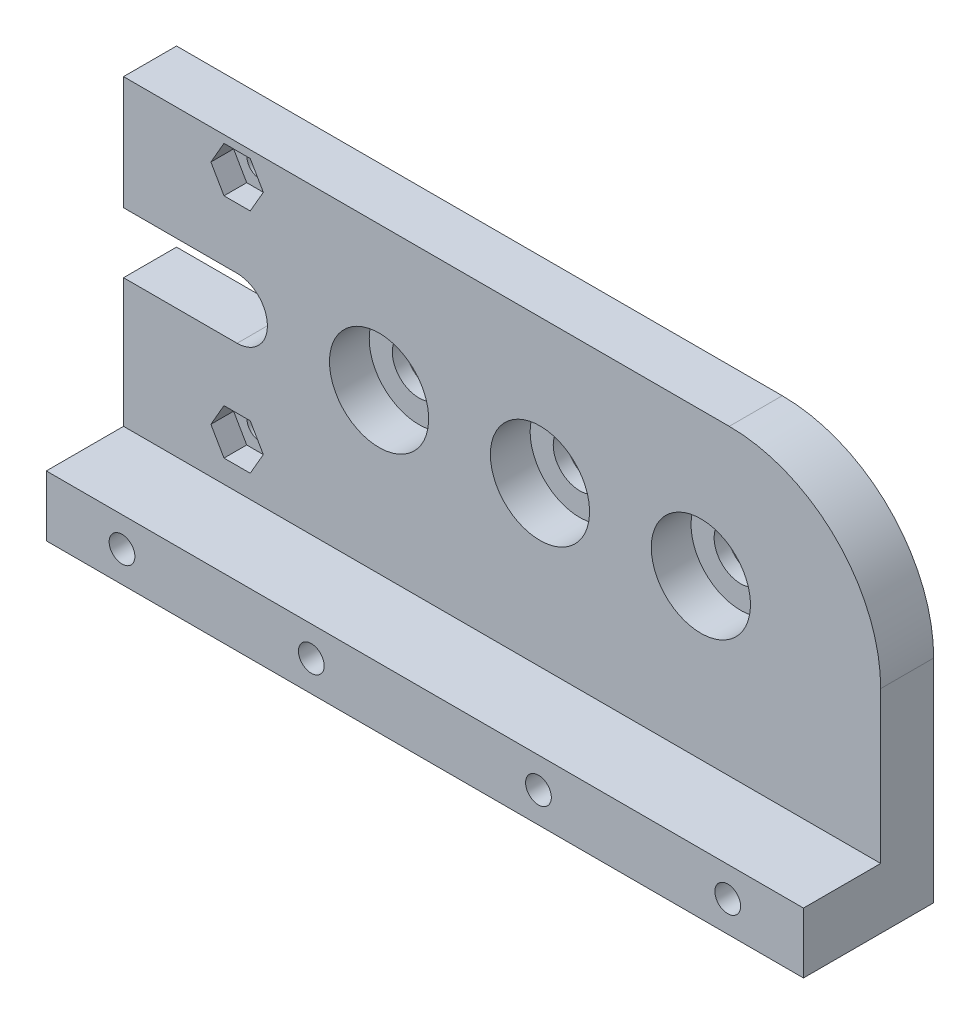
from build123d import *

# Parameters (mm, degrees)
SKETCH1_W           = 100
SKETCH1_H           = 48
BOSS_EXTRUDE1_DEPTH = 7
CUT_EXTRUDE1_REACH  = 113.144
SKETCH2_R           = 4
SKETCH2_R_2         = 3.5
SKETCH3_W           = 100
SKETCH3_H           = 8
BOSS_EXTRUDE2_DEPTH = 10.2
SKETCH4_R           = 6.55
CUT_EXTRUDE2_DEPTH  = 5.25
SKETCH5_R           = 2.6
CUT_EXTRUDE3_DEPTH  = 7
SKETCH7_R           = 1.7
CUT_EXTRUDE4_DEPTH  = 112.391382072
CUT_EXTRUDE5_REACH  = 114.249
SKETCH8_R           = 1.7
CUT_EXTRUDE6_DEPTH  = 3
CUT_EXTRUDE7_REACH  = 114.249
SKETCH10_R          = 1.7
CUT_EXTRUDE8_DEPTH  = 3
FILLET1_R           = 20


with BuildPart() as part:
    # Sketch1 → Boss-Extrude1 (new body)
    with BuildSketch(Plane.XY):
        with Locations((50, 24)):
            Rectangle(SKETCH1_W, SKETCH1_H)
    extrude(amount=BOSS_EXTRUDE1_DEPTH)

    # Sketch2 → Cut-Extrude1 (cut, up to next)
    with BuildSketch(Plane.XY.offset(7), mode=Mode.PRIVATE) as cut_extrude1_sk1:
        with BuildLine():
            ThreePointArc((15, 25), (11, 29), (15, 33))
            Line((15, 33), (0, 33))
            Line((0, 33), (0, 25))
            Line((0, 25), (15, 25))
        make_face()
    cut_extrude1_tool1 = extrude(cut_extrude1_sk1.sketch, amount=-CUT_EXTRUDE1_REACH, mode=Mode.PRIVATE) & part.part
    # Sketch2 → Cut-Extrude1 (cut, up to next)
    with BuildSketch(Plane.XY.offset(7), mode=Mode.PRIVATE) as cut_extrude1_sk2:
        with Locations((15, 29)):
            Circle(SKETCH2_R)
    cut_extrude1_tool2 = extrude(cut_extrude1_sk2.sketch, amount=-CUT_EXTRUDE1_REACH, mode=Mode.PRIVATE) & part.part
    # Sketch2 → Cut-Extrude1 (cut, up to next)
    with BuildSketch(Plane.XY.offset(7), mode=Mode.PRIVATE) as cut_extrude1_sk3:
        with Locations((33.75, 29)):
            Circle(SKETCH2_R_2)
    cut_extrude1_tool3 = extrude(cut_extrude1_sk3.sketch, amount=-CUT_EXTRUDE1_REACH, mode=Mode.PRIVATE) & part.part
    # Sketch2 → Cut-Extrude1 (cut, up to next)
    with BuildSketch(Plane.XY.offset(7), mode=Mode.PRIVATE) as cut_extrude1_sk4:
        with Locations((55, 29)):
            Circle(SKETCH2_R_2)
    cut_extrude1_tool4 = extrude(cut_extrude1_sk4.sketch, amount=-CUT_EXTRUDE1_REACH, mode=Mode.PRIVATE) & part.part
    # Sketch2 → Cut-Extrude1 (cut, up to next)
    with BuildSketch(Plane.XY.offset(7), mode=Mode.PRIVATE) as cut_extrude1_sk5:
        with Locations((76.25, 29)):
            Circle(SKETCH2_R_2)
    cut_extrude1_tool5 = extrude(cut_extrude1_sk5.sketch, amount=-CUT_EXTRUDE1_REACH, mode=Mode.PRIVATE) & part.part
    add(cut_extrude1_tool1.solids().sort_by_distance((5.962811, 29, 7))[0], mode=Mode.SUBTRACT)
    add(cut_extrude1_tool2.solids().sort_by_distance((15, 29, 7))[0], mode=Mode.SUBTRACT)
    add(cut_extrude1_tool3.solids().sort_by_distance((33.75, 29, 7))[0], mode=Mode.SUBTRACT)
    add(cut_extrude1_tool4.solids().sort_by_distance((55, 29, 7))[0], mode=Mode.SUBTRACT)
    add(cut_extrude1_tool5.solids().sort_by_distance((76.25, 29, 7))[0], mode=Mode.SUBTRACT)

    # Sketch3 → Boss-Extrude2 (add)
    with BuildSketch(Plane(origin=(0, 0, 0), x_dir=(-1, 0, 0), z_dir=(0, 0, -1))):
        with Locations((-50, 4)):
            Rectangle(SKETCH3_W, SKETCH3_H)
    extrude(amount=BOSS_EXTRUDE2_DEPTH)

    # Sketch4 → Cut-Extrude2 (cut)
    with BuildSketch(Plane(origin=(0, 0, 0), x_dir=(-1, 0, 0), z_dir=(0, 0, -1))):
        with Locations((-76.25, 29)):
            Circle(SKETCH4_R)
        with Locations((-55, 29)):
            Circle(SKETCH4_R)
        with Locations((-33.75, 29)):
            Circle(SKETCH4_R)
    extrude(amount=-CUT_EXTRUDE2_DEPTH, mode=Mode.SUBTRACT)

    # Sketch5 → Cut-Extrude3 (cut)
    with BuildSketch(Plane.XY.offset(7)):
        with Locations((35.000022648, 4.052132501)):
            Circle(SKETCH5_R)
        with Locations((64.999977352, 4)):
            Circle(SKETCH5_R)
    extrude(amount=-CUT_EXTRUDE3_DEPTH, mode=Mode.SUBTRACT)

    # Sketch7 → Cut-Extrude4 (cut, through all)
    with BuildSketch(Plane.XY):
        with Locations((35.000022648, 4.052132501)):
            Circle(SKETCH7_R)
        with Locations((64.999977352, 4)):
            Circle(SKETCH7_R)
    extrude(amount=-CUT_EXTRUDE4_DEPTH, mode=Mode.SUBTRACT)

    # Sketch8 → Cut-Extrude5 (cut, up to next)
    with BuildSketch(Plane.XY.offset(7), mode=Mode.PRIVATE) as cut_extrude5_sk1:
        with Locations((10, 4.052132501)):
            Circle(SKETCH8_R)
    cut_extrude5_tool1 = extrude(cut_extrude5_sk1.sketch, amount=-CUT_EXTRUDE5_REACH, mode=Mode.PRIVATE) & part.part
    # Sketch8 → Cut-Extrude5 (cut, up to next)
    with BuildSketch(Plane.XY.offset(7), mode=Mode.PRIVATE) as cut_extrude5_sk2:
        with Locations((90, 4.052132501)):
            Circle(SKETCH8_R)
    cut_extrude5_tool2 = extrude(cut_extrude5_sk2.sketch, amount=-CUT_EXTRUDE5_REACH, mode=Mode.PRIVATE) & part.part
    add(cut_extrude5_tool1.solids().sort_by_distance((10, 4.052133, 7))[0], mode=Mode.SUBTRACT)
    add(cut_extrude5_tool2.solids().sort_by_distance((90, 4.052133, 7))[0], mode=Mode.SUBTRACT)


with BuildPart() as body_2:
    # Mirror1: mirrored copy
    add(part.part.mirror(Plane.XY.offset(-10.2)))

    # Sketch9 → Cut-Extrude6 (cut)
    with BuildSketch(Plane(origin=(0, 0, -27.4), x_dir=(-1, 0, 0), z_dir=(0, 0, -1))):
        Polygon((-88.267949192, 1.052132501), (-86.535898385, 4.052132501), (-88.267949192, 7.052132501), (-91.732050808, 7.052132501), (-93.464101615, 4.052132501), (-91.732050808, 1.052132501), align=None)
        Polygon((-13.464101615, 4.052132501), (-11.732050808, 1.052132501), (-8.267949192, 1.052132501), (-6.535898385, 4.052132501), (-8.267949192, 7.052132501), (-11.732050808, 7.052132501), align=None)
    extrude(amount=-CUT_EXTRUDE6_DEPTH, mode=Mode.SUBTRACT)

    # Sketch10 → Cut-Extrude7 (cut, up to next)
    with BuildSketch(Plane(origin=(0, 0, -27.4), x_dir=(-1, 0, 0), z_dir=(0, 0, -1)), mode=Mode.PRIVATE) as cut_extrude7_sk1:
        with Locations((-15, 44)):
            Circle(SKETCH10_R)
    cut_extrude7_tool1 = extrude(cut_extrude7_sk1.sketch, amount=-CUT_EXTRUDE7_REACH, mode=Mode.PRIVATE) & body_2.part
    # Sketch10 → Cut-Extrude7 (cut, up to next)
    with BuildSketch(Plane(origin=(0, 0, -27.4), x_dir=(-1, 0, 0), z_dir=(0, 0, -1)), mode=Mode.PRIVATE) as cut_extrude7_sk2:
        with Locations((-15, 14)):
            Circle(SKETCH10_R)
    cut_extrude7_tool2 = extrude(cut_extrude7_sk2.sketch, amount=-CUT_EXTRUDE7_REACH, mode=Mode.PRIVATE) & body_2.part
    add(cut_extrude7_tool1.solids().sort_by_distance((15, 44, -27.4))[0], mode=Mode.SUBTRACT)
    add(cut_extrude7_tool2.solids().sort_by_distance((15, 14, -27.4))[0], mode=Mode.SUBTRACT)

    # Sketch11 → Cut-Extrude8 (cut)
    with BuildSketch(Plane.XY.offset(-20.4)):
        Polygon((18.464101615, 44), (16.732050808, 47), (13.267949192, 47), (11.535898385, 44), (13.267949192, 41), (16.732050808, 41), align=None)
        Polygon((18.464101615, 14), (16.732050808, 17), (13.267949192, 17), (11.535898385, 14), (13.267949192, 11), (16.732050808, 11), align=None)
    extrude(amount=-CUT_EXTRUDE8_DEPTH, mode=Mode.SUBTRACT)

    # Fillet1
    fillet1_edges = [body_2.edges().sort_by_distance(p)[0] for p in [
        (100, 48, -23.9),
    ]]
    fillet(fillet1_edges, radius=FILLET1_R)


solid = body_2.part
